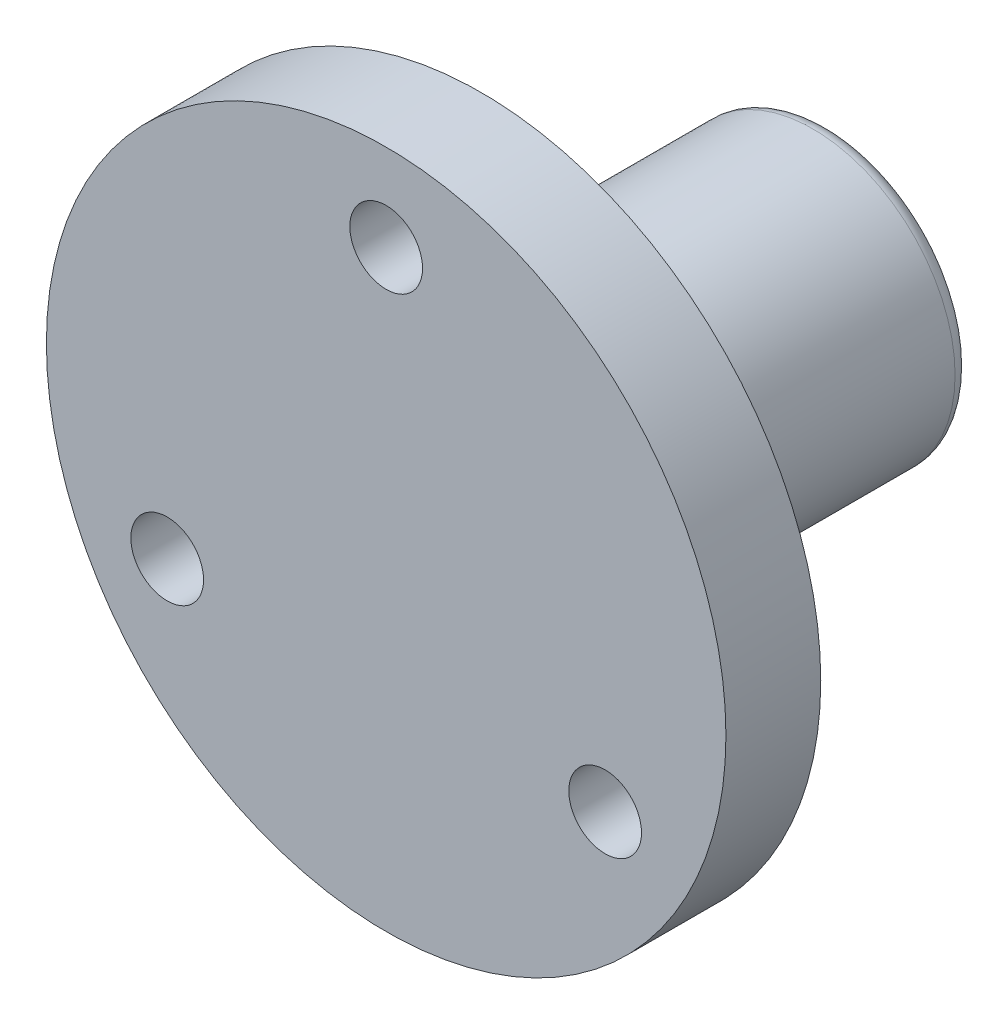
from build123d import *

# Parameters (mm, degrees)
SKETCH1_R           = 4.5
BOSS_EXTRUDE1_DEPTH = 11
SKETCH2_R           = 10.75
SKETCH2_R_2         = 1.15
BOSS_EXTRUDE2_DEPTH = 3
CUT_EXTRUDE1_DEPTH  = 1
CHAMFER1_SIZE       = 1
FILLET1_R           = 0.5


with BuildPart() as part:
    # Sketch1 → Boss-Extrude1 (new body)
    with BuildSketch(Plane.XY):
        with Locations((19.925, -7)):
            Circle(SKETCH1_R)
        with BuildLine():
            Line((18.146986881, -4.583666134), (21.703013119, -4.583666134))
            ThreePointArc((21.703013119, -4.583666134), (19.925, -10), (18.146986881, -4.583666134))
        make_face(mode=Mode.SUBTRACT)
    extrude(amount=-BOSS_EXTRUDE1_DEPTH)

    # Sketch2 → Boss-Extrude2 (add)
    with BuildSketch(Plane.XY):
        with Locations((19.925, -7)):
            Circle(SKETCH2_R)
        with Locations((19.925, 1)):
            Circle(SKETCH2_R_2, mode=Mode.SUBTRACT)
        with Locations((12.99679677, -11)):
            Circle(SKETCH2_R_2, mode=Mode.SUBTRACT)
        with Locations((26.85320323, -11)):
            Circle(SKETCH2_R_2, mode=Mode.SUBTRACT)
    extrude(amount=BOSS_EXTRUDE2_DEPTH)

    # Sketch3 → Cut-Extrude1 (cut)
    with BuildSketch(Plane(origin=(0, 0, 0), x_dir=(-1, 0, 0), z_dir=(0, 0, -1))):
        Polygon((-25.583032638, -8.8), (-28.123373822, -8.8), (-29.393544415, -11), (-28.123373822, -13.2), (-25.583032638, -13.2), (-24.312862046, -11), align=None)
        Polygon((-22.465341184, 1), (-21.195170592, -1.2), (-18.654829408, -1.2), (-17.384658816, 1), (-18.654829408, 3.2), (-21.195170592, 3.2), align=None)
        Polygon((-14.266967362, -8.8), (-15.537137954, -11), (-14.266967362, -13.2), (-11.726626178, -13.2), (-10.456455585, -11), (-11.726626178, -8.8), align=None)
    extrude(amount=-CUT_EXTRUDE1_DEPTH, mode=Mode.SUBTRACT)

    # Chamfer1
    chamfer1_edges = [part.edges().sort_by_distance(p)[0] for p in [
        (15.425, -7, 0),
    ]]
    chamfer(chamfer1_edges, length=CHAMFER1_SIZE)

    # Fillet1
    fillet1_edges = [part.edges().sort_by_distance(p)[0] for p in [
        (15.425, -7, -11),
    ]]
    fillet(fillet1_edges, radius=FILLET1_R)


solid = part.part
